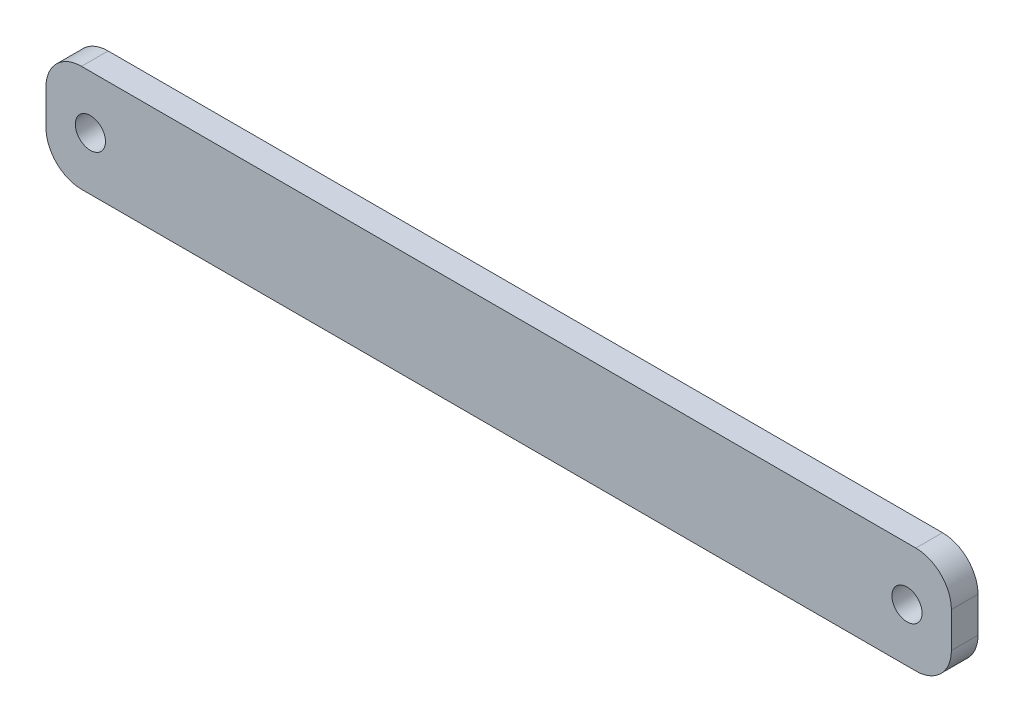
from build123d import *

# Parameters (mm, degrees)
BOSS_EXTRUDE1_DEPTH = 3
SKETCH2_R           = 1.7
CUT_EXTRUDE1_DEPTH  = 52.439284598


with BuildPart() as part:
    # Sketch1 → Boss-Extrude1 (new body)
    with BuildSketch(Plane.XY):
        with BuildLine():
            Line((-47, -6), (47, -6))
            ThreePointArc((47, -6), (49.828427125, -4.828427125), (51, -2))
            Line((51, -2), (51, 2))
            ThreePointArc((51, 2), (49.828427125, 4.828427125), (47, 6))
            Line((47, 6), (-47, 6))
            ThreePointArc((-47, 6), (-49.828427125, 4.828427125), (-51, 2))
            Line((-51, 2), (-51, -2))
            ThreePointArc((-51, -2), (-49.828427125, -4.828427125), (-47, -6))
        make_face()
    extrude(amount=BOSS_EXTRUDE1_DEPTH)

    # Sketch2 → Cut-Extrude1 (cut, through all)
    with BuildSketch(Plane.XY.offset(3)):
        with Locations((-46, 0)):
            Circle(SKETCH2_R)
        with Locations((46, 0)):
            Circle(SKETCH2_R)
    extrude(amount=-CUT_EXTRUDE1_DEPTH, mode=Mode.SUBTRACT)


solid = part.part
